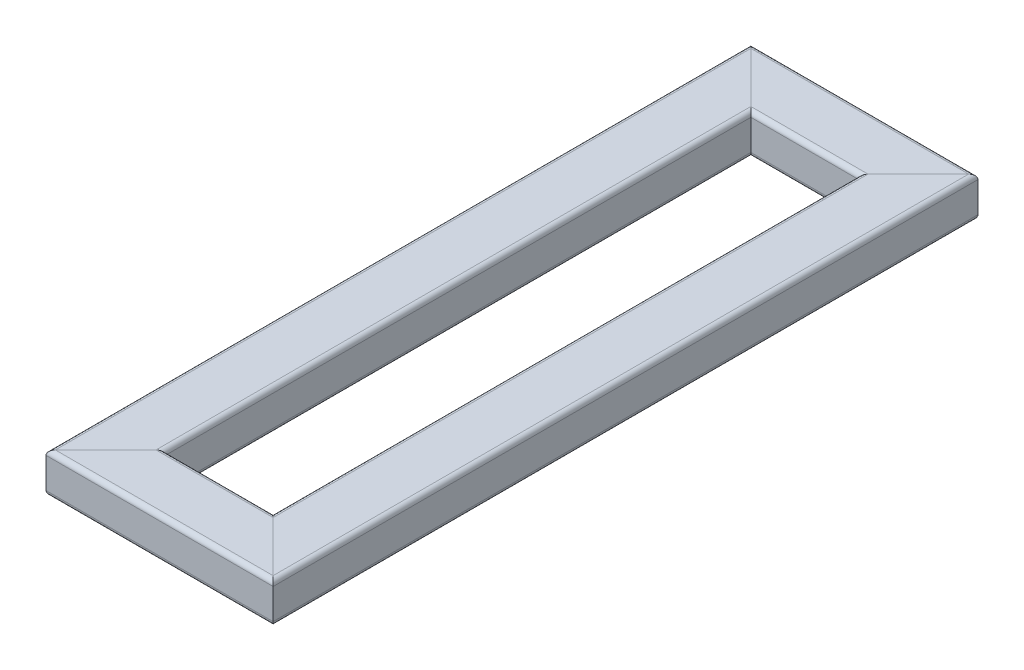
from build123d import *

# Parameters (mm, degrees)
TUBO_RECTANGULAR_3_X_2_X_0_25_1_DEPTH      = 992.581002397
TUBO_RECTANGULAR_3_X_2_X_0_25_1_DEPTH_BACK = 92.581002397
TUBO_RECTANGULAR_3_X_2_X_0_25_1_2_DEPTH    = 475.162004794
TUBO_RECTANGULAR_3_X_2_X_0_25_1_3_DEPTH    = 1085.162004794
TUBO_RECTANGULAR_3_X_2_X_0_25_1_4_DEPTH    = 475.162004794


with BuildPart() as part:
    # Sketch1 → Tubo rectangular 3 X 2 X 0.25(1) (new, two sides: drawn at the far end of the back side and taken through both)
    with BuildSketch(Plane(origin=(-106.9, 25.4, -450), x_dir=(1, 0, 0), z_dir=(0, 0, 1)).offset(-TUBO_RECTANGULAR_3_X_2_X_0_25_1_DEPTH_BACK)):
        with BuildLine():
            Line((-32.1, -25.4), (32.1, -25.4))
            ThreePointArc((32.1, -25.4), (36.342640687, -23.642640687), (38.1, -19.4))
            Line((38.1, -19.4), (38.1, 19.4))
            ThreePointArc((38.1, 19.4), (36.342640687, 23.642640687), (32.1, 25.4))
            Line((32.1, 25.4), (-32.1, 25.4))
            ThreePointArc((-32.1, 25.4), (-36.342640687, 23.642640687), (-38.1, 19.4))
            Line((-38.1, 19.4), (-38.1, -19.4))
            ThreePointArc((-38.1, -19.4), (-36.342640687, -23.642640687), (-32.1, -25.4))
        make_face()
        with BuildLine():
            Line((-32.1, -22.4), (32.1, -22.4))
            ThreePointArc((32.1, -22.4), (34.221320344, -21.521320344), (35.1, -19.4))
            Line((35.1, -19.4), (35.1, 19.4))
            ThreePointArc((35.1, 19.4), (34.221320344, 21.521320344), (32.1, 22.4))
            Line((32.1, 22.4), (-32.1, 22.4))
            ThreePointArc((-32.1, 22.4), (-34.221320344, 21.521320344), (-35.1, 19.4))
            Line((-35.1, 19.4), (-35.1, -19.4))
            ThreePointArc((-35.1, -19.4), (-34.221320344, -21.521320344), (-32.1, -22.4))
        make_face(mode=Mode.SUBTRACT)
    extrude(amount=TUBO_RECTANGULAR_3_X_2_X_0_25_1_DEPTH + TUBO_RECTANGULAR_3_X_2_X_0_25_1_DEPTH_BACK)

    # Tubo rectangular 3 X 2 X 0.25(1) mitre 1
    split(bisect_by=Plane(origin=(-145, 0, -450), x_dir=(0, -1, 0), z_dir=(-0.707106781, 0, 0.707106781)), keep=Keep.TOP)

    # Tubo rectangular 3 X 2 X 0.25(1) mitre 2
    split(bisect_by=Plane(origin=(-145, 0, 450), x_dir=(0, -1, 0), z_dir=(-0.707106781, 0, -0.707106781)), keep=Keep.TOP)


with BuildPart() as body_2:
    # Sketch1 on segment 2 (carried to segment 2) → Tubo rectangular 3 X 2 X 0.25_1 2 (new body)
    with BuildSketch(Plane(origin=(-237.581002397, 25.4, 411.9), x_dir=(0, 0, -1), z_dir=(1, 0, 0))):
        with BuildLine():
            Line((-32.1, -25.4), (32.1, -25.4))
            ThreePointArc((32.1, -25.4), (36.342640687, -23.642640687), (38.1, -19.4))
            Line((38.1, -19.4), (38.1, 19.4))
            ThreePointArc((38.1, 19.4), (36.342640687, 23.642640687), (32.1, 25.4))
            Line((32.1, 25.4), (-32.1, 25.4))
            ThreePointArc((-32.1, 25.4), (-36.342640687, 23.642640687), (-38.1, 19.4))
            Line((-38.1, 19.4), (-38.1, -19.4))
            ThreePointArc((-38.1, -19.4), (-36.342640687, -23.642640687), (-32.1, -25.4))
        make_face()
        with BuildLine():
            Line((-32.1, -22.4), (32.1, -22.4))
            ThreePointArc((32.1, -22.4), (34.221320344, -21.521320344), (35.1, -19.4))
            Line((35.1, -19.4), (35.1, 19.4))
            ThreePointArc((35.1, 19.4), (34.221320344, 21.521320344), (32.1, 22.4))
            Line((32.1, 22.4), (-32.1, 22.4))
            ThreePointArc((-32.1, 22.4), (-34.221320344, 21.521320344), (-35.1, 19.4))
            Line((-35.1, 19.4), (-35.1, -19.4))
            ThreePointArc((-35.1, -19.4), (-34.221320344, -21.521320344), (-32.1, -22.4))
        make_face(mode=Mode.SUBTRACT)
    extrude(amount=TUBO_RECTANGULAR_3_X_2_X_0_25_1_2_DEPTH)

    # Tubo rectangular 3 X 2 X 0.25_1 2 mitre
    split(bisect_by=Plane(origin=(-145, 0, 450), x_dir=(0, 1, 0), z_dir=(0.707106781, 0, 0.707106781)), keep=Keep.TOP)

    # Tubo rectangular 3 X 2 X 0.25_1 2 mi 2
    split(bisect_by=Plane(origin=(145, 0, 450), x_dir=(0, -1, 0), z_dir=(-0.707106781, 0, 0.707106781)), keep=Keep.TOP)


with BuildPart() as body_3:
    # Sketch1 on segment 3 (carried to segment 3) → Tubo rectangular 3 X 2 X 0.25_1 3 (new body)
    with BuildSketch(Plane(origin=(106.9, 25.4, 542.581002397), x_dir=(-1, 0, 0), z_dir=(0, 0, -1))):
        with BuildLine():
            Line((-32.1, -25.4), (32.1, -25.4))
            ThreePointArc((32.1, -25.4), (36.342640687, -23.642640687), (38.1, -19.4))
            Line((38.1, -19.4), (38.1, 19.4))
            ThreePointArc((38.1, 19.4), (36.342640687, 23.642640687), (32.1, 25.4))
            Line((32.1, 25.4), (-32.1, 25.4))
            ThreePointArc((-32.1, 25.4), (-36.342640687, 23.642640687), (-38.1, 19.4))
            Line((-38.1, 19.4), (-38.1, -19.4))
            ThreePointArc((-38.1, -19.4), (-36.342640687, -23.642640687), (-32.1, -25.4))
        make_face()
        with BuildLine():
            Line((-32.1, -22.4), (32.1, -22.4))
            ThreePointArc((32.1, -22.4), (34.221320344, -21.521320344), (35.1, -19.4))
            Line((35.1, -19.4), (35.1, 19.4))
            ThreePointArc((35.1, 19.4), (34.221320344, 21.521320344), (32.1, 22.4))
            Line((32.1, 22.4), (-32.1, 22.4))
            ThreePointArc((-32.1, 22.4), (-34.221320344, 21.521320344), (-35.1, 19.4))
            Line((-35.1, 19.4), (-35.1, -19.4))
            ThreePointArc((-35.1, -19.4), (-34.221320344, -21.521320344), (-32.1, -22.4))
        make_face(mode=Mode.SUBTRACT)
    extrude(amount=TUBO_RECTANGULAR_3_X_2_X_0_25_1_3_DEPTH)

    # Tubo rectangular 3 X 2 X 0.25_1 3 mitre
    split(bisect_by=Plane(origin=(145, 0, -450), x_dir=(0, 1, 0), z_dir=(0.707106781, 0, 0.707106781)), keep=Keep.TOP)

    # Tubo rectangular 3 X 2 X 0.25_1 3 mi 2
    split(bisect_by=Plane(origin=(145, 0, 450), x_dir=(0, 1, 0), z_dir=(0.707106781, 0, -0.707106781)), keep=Keep.TOP)


with BuildPart() as body_4:
    # Sketch1 on segment 4 (carried to segment 4) → Tubo rectangular 3 X 2 X 0.25_1 4 (new body)
    with BuildSketch(Plane(origin=(237.581002397, 25.4, -411.9), x_dir=(0, 0, 1), z_dir=(-1, 0, 0))):
        with BuildLine():
            Line((-32.1, -25.4), (32.1, -25.4))
            ThreePointArc((32.1, -25.4), (36.342640687, -23.642640687), (38.1, -19.4))
            Line((38.1, -19.4), (38.1, 19.4))
            ThreePointArc((38.1, 19.4), (36.342640687, 23.642640687), (32.1, 25.4))
            Line((32.1, 25.4), (-32.1, 25.4))
            ThreePointArc((-32.1, 25.4), (-36.342640687, 23.642640687), (-38.1, 19.4))
            Line((-38.1, 19.4), (-38.1, -19.4))
            ThreePointArc((-38.1, -19.4), (-36.342640687, -23.642640687), (-32.1, -25.4))
        make_face()
        with BuildLine():
            Line((-32.1, -22.4), (32.1, -22.4))
            ThreePointArc((32.1, -22.4), (34.221320344, -21.521320344), (35.1, -19.4))
            Line((35.1, -19.4), (35.1, 19.4))
            ThreePointArc((35.1, 19.4), (34.221320344, 21.521320344), (32.1, 22.4))
            Line((32.1, 22.4), (-32.1, 22.4))
            ThreePointArc((-32.1, 22.4), (-34.221320344, 21.521320344), (-35.1, 19.4))
            Line((-35.1, 19.4), (-35.1, -19.4))
            ThreePointArc((-35.1, -19.4), (-34.221320344, -21.521320344), (-32.1, -22.4))
        make_face(mode=Mode.SUBTRACT)
    extrude(amount=TUBO_RECTANGULAR_3_X_2_X_0_25_1_4_DEPTH)

    # Tubo rectangular 3 X 2 X 0.25_1 4 mitre
    split(bisect_by=Plane(origin=(-145, 0, -450), x_dir=(0, 1, 0), z_dir=(0.707106781, 0, -0.707106781)), keep=Keep.TOP)

    # Tubo rectangular 3 X 2 X 0.25_1 4 mi 2
    split(bisect_by=Plane(origin=(145, 0, -450), x_dir=(0, -1, 0), z_dir=(-0.707106781, 0, -0.707106781)), keep=Keep.TOP)


solid = Compound([part.part, body_2.part, body_3.part, body_4.part])
